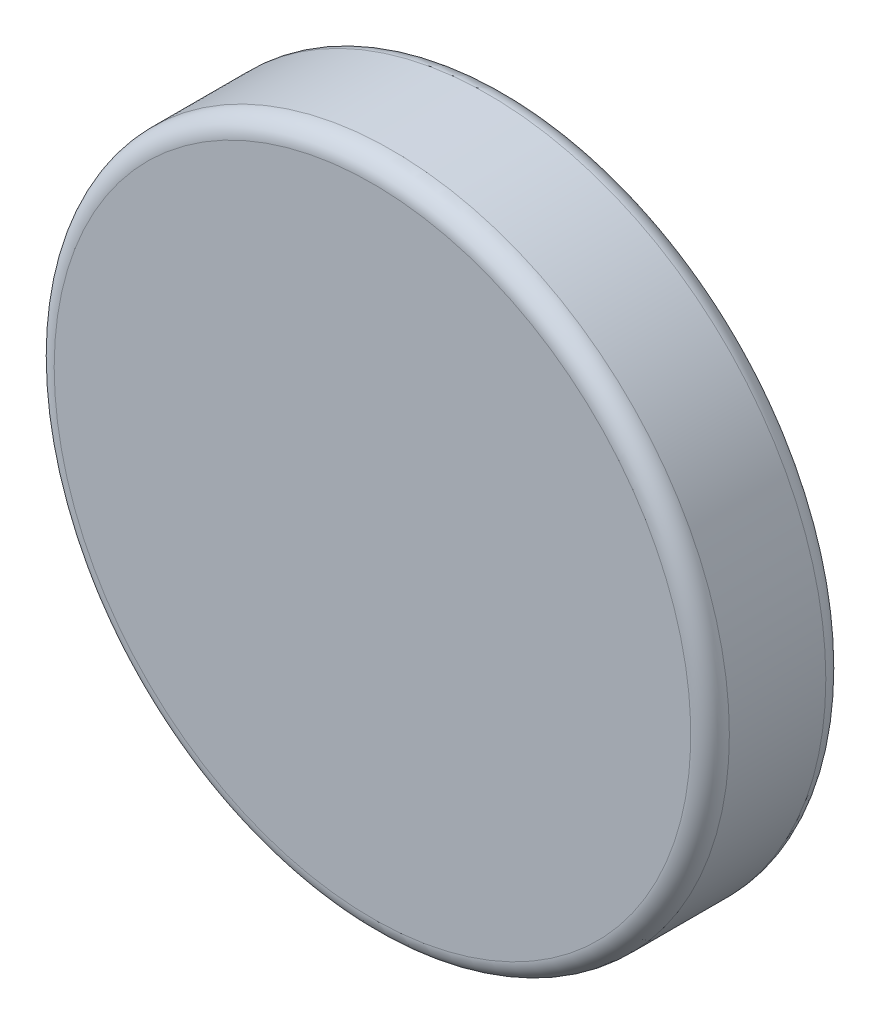
from build123d import *

# Parameters (mm, degrees)
SKETCH1_R           = 4
BOSS_EXTRUDE1_DEPTH = 1
BOSS_EXTRUDE2_DEPTH = 3.5
FILLET1_R           = 0.5
FILLET3_R           = 0.5


with BuildPart() as part:
    # Sketch1 → Boss-Extrude1 (new body)
    with BuildSketch(Plane.XY):
        with Locations((-133.270827388, 0)):
            Circle(SKETCH1_R)
    extrude(amount=BOSS_EXTRUDE1_DEPTH)

    # Sketch2 → Boss-Extrude2 (add)
    with BuildSketch(Plane.XY.offset(1)):
        with BuildLine():
            ThreePointArc((-125.3812469, 3.783783784), (-124.520827388, 0), (-125.3812469, -3.783783784))
            ThreePointArc((-125.3812469, -3.783783784), (-142.020827388, 0), (-125.3812469, 3.783783784))
        make_face()
    extrude(amount=BOSS_EXTRUDE2_DEPTH)

    # Fillet1
    fillet1_edges = [part.edges().sort_by_distance(p)[0] for p in [
        (-137.270827388, 0, 1),
        (-141.160407876, -3.783783784, 1),
    ]]
    fillet(fillet1_edges, radius=FILLET1_R)

    # Fillet3
    fillet3_edges = [part.edges().sort_by_distance(p)[0] for p in [
        (-141.160407876, -3.783783784, 4.5),
    ]]
    fillet(fillet3_edges, radius=FILLET3_R)


solid = part.part
